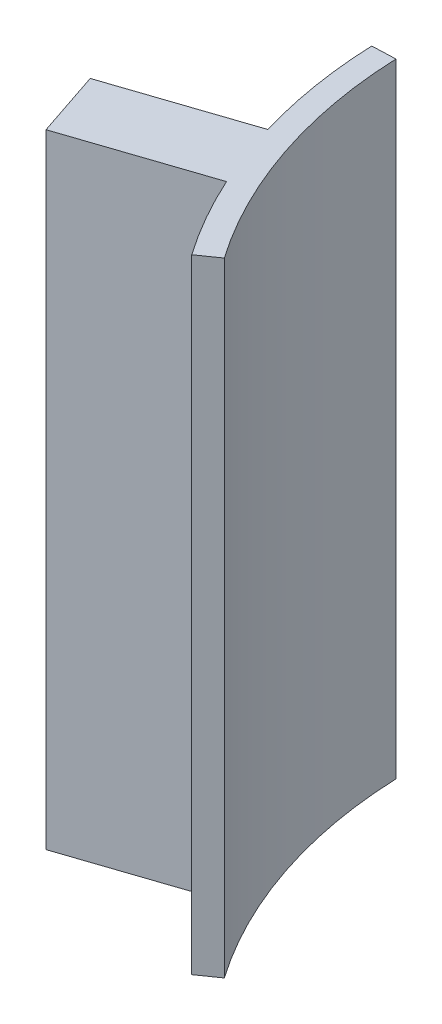
from build123d import *

# Parameters (mm, degrees)
BOSS_EXTRUDE1_DEPTH = 80


with BuildPart() as part:
    # Sketch1 → Boss-Extrude1 (new body)
    with BuildSketch(Plane(origin=(0, 0, 0), x_dir=(1, 0, 0), z_dir=(0, 1, 0))):
        with BuildLine():
            Line((-76.548755152, -32.649280907), (-59.202429764, -26.834163114))
            ThreePointArc((-59.202429764, -26.834163114), (-56.493069519, -32.148609555), (-53.307910951, -37.192292615))
            Line((-53.307910951, -37.192292615), (-50.847545831, -35.475725264))
            ThreePointArc((-50.847545831, -35.475725264), (-58.784718857, -19.706771143), (-61.955824005, -2.340058101))
            Line((-61.955824005, -2.340058101), (-64.953686456, -2.453286719))
            ThreePointArc((-64.953686456, -2.453286719), (-64.145431221, -10.505410678), (-62.342884198, -18.394694613))
            Line((-62.342884198, -18.394694613), (-79.409415479, -24.116015267))
            Line((-79.409415479, -24.116015267), (-76.548755152, -32.649280907))
        make_face()
    extrude(amount=BOSS_EXTRUDE1_DEPTH)


solid = part.part
